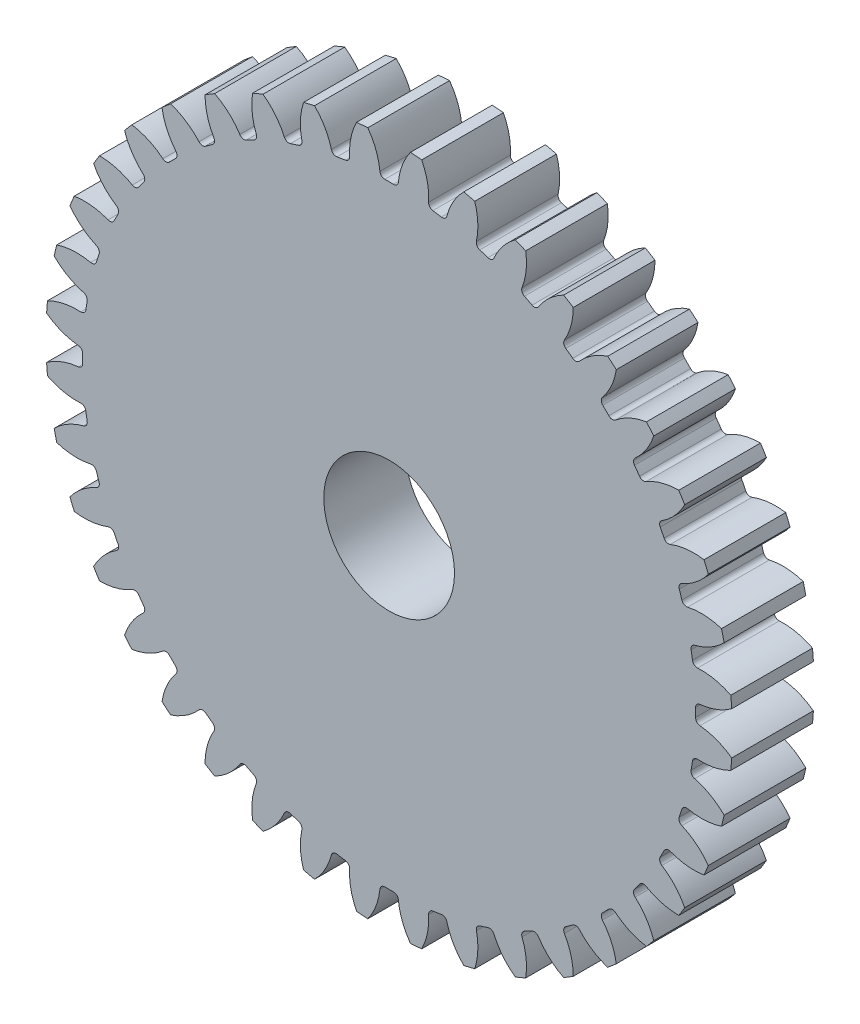
from build123d import *

# Parameters (mm, degrees)
SKETCH1_R                = 84
BOSS_EXTRUDE1_DEPTH      = 10
SKETCH2_R                = 16
CUT_EXTRUDE1_DEPTH       = 120.214093127
FILLET1_R                = 1.2
CIRPATTERN1_COUNT        = 40
FILLET1_OF_CIRPATTERN1_R = 1.2


with BuildPart() as part:
    # Sketch1 → Boss-Extrude1 (new, symmetric)
    with BuildSketch(Plane.XY):
        Circle(SKETCH1_R)
    extrude(amount=BOSS_EXTRUDE1_DEPTH, both=True)

    # Sketch2 → Cut-Extrude1 (cut, symmetric)
    with BuildSketch(Plane.XY):
        Circle(SKETCH2_R)
        with BuildLine():
            ThreePointArc((-5.961946502, 84.79065511), (-3.238916407, 80.200714988), (-2.189379631, 74.968037301))
            ThreePointArc((-2.189379631, 74.968037301), (0, 75), (2.189379631, 74.968037301))
            ThreePointArc((2.189379631, 74.968037301), (3.238916407, 80.200714988), (5.961946502, 84.79065511))
            ThreePointArc((5.961946502, 84.79065511), (0, 85), (-5.961946502, 84.79065511))
        make_face()
    cut_extrude1 = extrude(amount=CUT_EXTRUDE1_DEPTH, both=True, mode=Mode.SUBTRACT)

    # Fillet1
    fillet1_edges = [part.edges().sort_by_distance(p)[0] for p in [
        (-2.189379631, 74.968037301, 0),
        (2.189379631, 74.968037301, 0),
    ]]
    fillet(fillet1_edges, radius=FILLET1_R)

    # CirPattern1: Cut-Extrude1 ×40 about axis
    cirpattern1_axis = Axis((0, 0, 0), (0, 0, 1))
    for i in range(1, CIRPATTERN1_COUNT):
        add(cut_extrude1.rotate(cirpattern1_axis, i * 360 / CIRPATTERN1_COUNT), mode=Mode.SUBTRACT)

    # Fillet1 of CirPattern1
    fillet1_of_cirpattern1_edges = [part.edges().sort_by_distance(p)[0] for p in [
        (-13.890009545, 73.702561929, 0),
        (-9.565160076, 74.387550791, 0),
        (-25.248621326, 70.622284876, 0),
        (-21.084173797, 71.975395902, 0),
        (-35.985528254, 65.803052788, 0),
        (-32.084025184, 67.790967894, 0),
        (-45.836352048, 59.363531153, 0),
        (-42.293861391, 61.93730127, 0),
        (-54.558532732, 51.462282365, 0),
        (-51.462282365, 54.558532732, 0),
        (-61.93730127, 42.293861391, 0),
        (-59.363531153, 45.836352048, 0),
        (-67.790967894, 32.084025184, 0),
        (-65.803052788, 35.985528254, 0),
        (-71.975395902, 21.084173797, 0),
        (-70.622284876, 25.248621326, 0),
        (-74.387550791, 9.565160076, 0),
        (-73.702561929, 13.890009545, 0),
        (-74.968037301, -2.189379631, 0),
        (-74.968037301, 2.189379631, 0),
        (-73.702561929, -13.890009545, 0),
        (-74.387550791, -9.565160076, 0),
        (-70.622284876, -25.248621326, 0),
        (-71.975395902, -21.084173797, 0),
        (-65.803052788, -35.985528254, 0),
        (-67.790967894, -32.084025184, 0),
        (-59.363531153, -45.836352048, 0),
        (-61.93730127, -42.293861391, 0),
        (-51.462282365, -54.558532732, 0),
        (-54.558532732, -51.462282365, 0),
        (-42.293861391, -61.93730127, 0),
        (-45.836352048, -59.363531153, 0),
        (-32.084025184, -67.790967894, 0),
        (-35.985528254, -65.803052788, 0),
        (-21.084173797, -71.975395902, 0),
        (-25.248621326, -70.622284876, 0),
        (-9.565160076, -74.387550791, 0),
        (-13.890009545, -73.702561929, 0),
        (2.189379631, -74.968037301, 0),
        (-2.189379631, -74.968037301, 0),
        (13.890009545, -73.702561929, 0),
        (9.565160076, -74.387550791, 0),
        (25.248621326, -70.622284876, 0),
        (21.084173797, -71.975395902, 0),
        (35.985528254, -65.803052788, 0),
        (32.084025184, -67.790967894, 0),
        (45.836352048, -59.363531153, 0),
        (42.293861391, -61.93730127, 0),
        (54.558532732, -51.462282365, 0),
        (51.462282365, -54.558532732, 0),
        (61.93730127, -42.293861391, 0),
        (59.363531153, -45.836352048, 0),
        (67.790967894, -32.084025184, 0),
        (65.803052788, -35.985528254, 0),
        (71.975395902, -21.084173797, 0),
        (70.622284876, -25.248621326, 0),
        (74.387550791, -9.565160076, 0),
        (73.702561929, -13.890009545, 0),
        (74.968037301, 2.189379631, 0),
        (74.968037301, -2.189379631, 0),
        (73.702561929, 13.890009545, 0),
        (74.387550791, 9.565160076, 0),
        (70.622284876, 25.248621326, 0),
        (71.975395902, 21.084173797, 0),
        (65.803052788, 35.985528254, 0),
        (67.790967894, 32.084025184, 0),
        (59.363531153, 45.836352048, 0),
        (61.93730127, 42.293861391, 0),
        (51.462282365, 54.558532732, 0),
        (54.558532732, 51.462282365, 0),
        (42.293861391, 61.93730127, 0),
        (45.836352048, 59.363531153, 0),
        (32.084025184, 67.790967894, 0),
        (35.985528254, 65.803052788, 0),
        (21.084173797, 71.975395902, 0),
        (25.248621326, 70.622284876, 0),
        (9.565160076, 74.387550791, 0),
        (13.890009545, 73.702561929, 0),
    ]]
    fillet(fillet1_of_cirpattern1_edges, radius=FILLET1_OF_CIRPATTERN1_R)


solid = part.part
